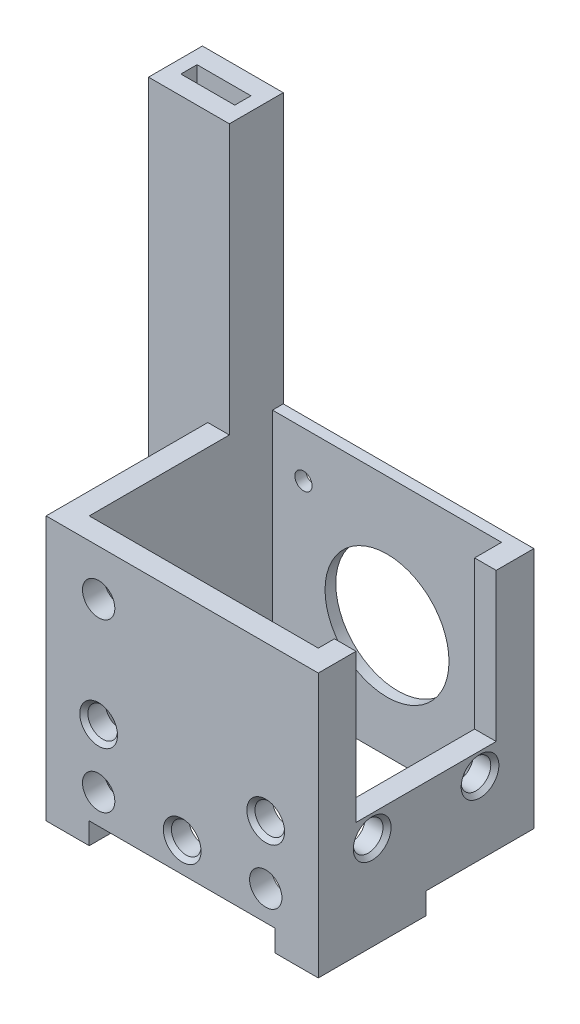
from build123d import *

# Parameters (mm, degrees)
SKETCH2_W                = 50.5
SKETCH2_H                = 40
SKETCH2_W_2              = 42.5
SKETCH2_H_2              = 34
BOSS_EXTRUDE1_DEPTH      = 45
CUT_EXTRUDE1_REACH       = 72.825
SKETCH3_W                = 26
SKETCH3_H                = 27.5
CUT_EXTRUDE2_REACH       = 67.288
SKETCH4_R                = 11.5
SKETCH4_R_2              = 1.6
CUT_EXTRUDE3_REACH       = 67.288
SKETCH5_R                = 3
CUT_EXTRUDE4_REACH       = 67.288
SKETCH6_R                = 2.75
SKETCH7_R                = 2.75
CUT_EXTRUDE5_DEPTH       = 71.825489762
SKETCH8_W                = 8
SKETCH8_H                = 25
BOSS_EXTRUDE2_DEPTH      = 4
SKETCH9_R                = 2.25
CUT_EXTRUDE6_DEPTH       = 4
CHAMFER1_SIZE            = 0.75
BOSS_EXTRUDE3_DEPTH      = 50
BOSS_EXTRUDE3_DEPTH_BACK = 25
SKETCH10_W               = 15
SKETCH10_H               = 10
SKETCH11_W               = 10
SKETCH11_H               = 3
CUT_EXTRUDE7_DEPTH       = 75


with BuildPart() as part:
    # Sketch2 → Boss-Extrude1 (new body)
    with BuildSketch(Plane(origin=(0, 0, 0), x_dir=(1, 0, 0), z_dir=(0, 1, 0))):
        with Locations((0, -1)):
            Rectangle(SKETCH2_W, SKETCH2_H)
        Rectangle(SKETCH2_W_2, SKETCH2_H_2, mode=Mode.SUBTRACT)
    extrude(amount=BOSS_EXTRUDE1_DEPTH)

    # Sketch3 → Cut-Extrude1 (cut, up to next)
    with BuildSketch(Plane(origin=(25.25, 0, 0), x_dir=(0, 0, -1), z_dir=(1, 0, 0)), mode=Mode.PRIVATE) as cut_extrude1_sk1:
        with Locations((-1, 31.25)):
            Rectangle(SKETCH3_W, SKETCH3_H)
    cut_extrude1_tool1 = extrude(cut_extrude1_sk1.sketch, amount=-CUT_EXTRUDE1_REACH, mode=Mode.PRIVATE) & part.part
    add(cut_extrude1_tool1.solids().sort_by_distance((25.25, 31.25, 1))[0], mode=Mode.SUBTRACT)

    # Sketch4 → Cut-Extrude2 (cut, up to next)
    with BuildSketch(Plane(origin=(0, 0, -19), x_dir=(-1, 0, 0), z_dir=(0, 0, -1)), mode=Mode.PRIVATE) as cut_extrude2_sk1:
        with Locations((0, 21)):
            Circle(SKETCH4_R)
    cut_extrude2_tool1 = extrude(cut_extrude2_sk1.sketch, amount=-CUT_EXTRUDE2_REACH, mode=Mode.PRIVATE) & part.part
    # Sketch4 → Cut-Extrude2 (cut, up to next)
    with BuildSketch(Plane(origin=(0, 0, -19), x_dir=(-1, 0, 0), z_dir=(0, 0, -1)), mode=Mode.PRIVATE) as cut_extrude2_sk2:
        with Locations((-15.5, 5.5)):
            Circle(SKETCH4_R_2)
    cut_extrude2_tool2 = extrude(cut_extrude2_sk2.sketch, amount=-CUT_EXTRUDE2_REACH, mode=Mode.PRIVATE) & part.part
    # Sketch4 → Cut-Extrude2 (cut, up to next)
    with BuildSketch(Plane(origin=(0, 0, -19), x_dir=(-1, 0, 0), z_dir=(0, 0, -1)), mode=Mode.PRIVATE) as cut_extrude2_sk3:
        with Locations((15.5, 5.5)):
            Circle(SKETCH4_R_2)
    cut_extrude2_tool3 = extrude(cut_extrude2_sk3.sketch, amount=-CUT_EXTRUDE2_REACH, mode=Mode.PRIVATE) & part.part
    # Sketch4 → Cut-Extrude2 (cut, up to next)
    with BuildSketch(Plane(origin=(0, 0, -19), x_dir=(-1, 0, 0), z_dir=(0, 0, -1)), mode=Mode.PRIVATE) as cut_extrude2_sk4:
        with Locations((15.5, 36.5)):
            Circle(SKETCH4_R_2)
    cut_extrude2_tool4 = extrude(cut_extrude2_sk4.sketch, amount=-CUT_EXTRUDE2_REACH, mode=Mode.PRIVATE) & part.part
    add(cut_extrude2_tool1.solids().sort_by_distance((0, 21, -19))[0], mode=Mode.SUBTRACT)
    add(cut_extrude2_tool2.solids().sort_by_distance((15.5, 5.5, -19))[0], mode=Mode.SUBTRACT)
    add(cut_extrude2_tool3.solids().sort_by_distance((-15.5, 5.5, -19))[0], mode=Mode.SUBTRACT)
    add(cut_extrude2_tool4.solids().sort_by_distance((-15.5, 36.5, -19))[0], mode=Mode.SUBTRACT)

    # Sketch5 → Cut-Extrude3 (cut, up to next)
    with BuildSketch(Plane.XY.offset(21), mode=Mode.PRIVATE) as cut_extrude3_sk1:
        with Locations((-15.5, 36.5)):
            Circle(SKETCH5_R)
    cut_extrude3_tool1 = extrude(cut_extrude3_sk1.sketch, amount=-CUT_EXTRUDE3_REACH, mode=Mode.PRIVATE) & part.part
    # Sketch5 → Cut-Extrude3 (cut, up to next)
    with BuildSketch(Plane.XY.offset(21), mode=Mode.PRIVATE) as cut_extrude3_sk2:
        with Locations((-15.5, 5.5)):
            Circle(SKETCH5_R)
    cut_extrude3_tool2 = extrude(cut_extrude3_sk2.sketch, amount=-CUT_EXTRUDE3_REACH, mode=Mode.PRIVATE) & part.part
    # Sketch5 → Cut-Extrude3 (cut, up to next)
    with BuildSketch(Plane.XY.offset(21), mode=Mode.PRIVATE) as cut_extrude3_sk3:
        with Locations((15.5, 5.5)):
            Circle(SKETCH5_R)
    cut_extrude3_tool3 = extrude(cut_extrude3_sk3.sketch, amount=-CUT_EXTRUDE3_REACH, mode=Mode.PRIVATE) & part.part
    add(cut_extrude3_tool1.solids().sort_by_distance((-15.5, 36.5, 21))[0], mode=Mode.SUBTRACT)
    add(cut_extrude3_tool2.solids().sort_by_distance((-15.5, 5.5, 21))[0], mode=Mode.SUBTRACT)
    add(cut_extrude3_tool3.solids().sort_by_distance((15.5, 5.5, 21))[0], mode=Mode.SUBTRACT)

    # Sketch6 → Cut-Extrude4 (cut, up to next)
    with BuildSketch(Plane.XY.offset(21), mode=Mode.PRIVATE) as cut_extrude4_sk1:
        with Locations((-15.5, 16.365063509)):
            Circle(SKETCH6_R)
    cut_extrude4_tool1 = extrude(cut_extrude4_sk1.sketch, amount=-CUT_EXTRUDE4_REACH, mode=Mode.PRIVATE) & part.part
    # Sketch6 → Cut-Extrude4 (cut, up to next)
    with BuildSketch(Plane.XY.offset(21), mode=Mode.PRIVATE) as cut_extrude4_sk2:
        with Locations((0, 5.5)):
            Circle(SKETCH6_R)
    cut_extrude4_tool2 = extrude(cut_extrude4_sk2.sketch, amount=-CUT_EXTRUDE4_REACH, mode=Mode.PRIVATE) & part.part
    # Sketch6 → Cut-Extrude4 (cut, up to next)
    with BuildSketch(Plane.XY.offset(21), mode=Mode.PRIVATE) as cut_extrude4_sk3:
        with Locations((15.5, 16.365063509)):
            Circle(SKETCH6_R)
    cut_extrude4_tool3 = extrude(cut_extrude4_sk3.sketch, amount=-CUT_EXTRUDE4_REACH, mode=Mode.PRIVATE) & part.part
    add(cut_extrude4_tool1.solids().sort_by_distance((-15.5, 16.365064, 21))[0], mode=Mode.SUBTRACT)
    add(cut_extrude4_tool2.solids().sort_by_distance((0, 5.5, 21))[0], mode=Mode.SUBTRACT)
    add(cut_extrude4_tool3.solids().sort_by_distance((15.5, 16.365064, 21))[0], mode=Mode.SUBTRACT)

    # Sketch7 → Cut-Extrude5 (cut, through all)
    with BuildSketch(Plane(origin=(25.25, 0, 0), x_dir=(0, 0, -1), z_dir=(1, 0, 0))):
        with Locations((-11, 13.440603491)):
            Circle(SKETCH7_R)
        with Locations((9, 13.440603491)):
            Circle(SKETCH7_R)
    extrude(amount=-CUT_EXTRUDE5_DEPTH, mode=Mode.SUBTRACT)

    # Sketch8 → Boss-Extrude2 (add)
    with BuildSketch(Plane.XZ):
        Polygon((19, 1), (17.25, 11), (17.25, 21), (25.25, 21), (25.25, 1), align=None)
        with Locations((-21.25, 8.5)):
            Rectangle(SKETCH8_W, SKETCH8_H)
    extrude(amount=BOSS_EXTRUDE2_DEPTH)

    # Sketch9 → Cut-Extrude6 (cut)
    with BuildSketch(Plane.XZ.offset(4)):
        with Locations(Location((-21.25, 13, 0), (0, 0, 270))):
            Circle(SKETCH9_R)
        with Locations(Location((-21.25, 0.5, 0), (0, 0, 270))):
            Circle(SKETCH9_R)
        with Locations(Location((21.25, 6, 0), (0, 0, 270))):
            Circle(SKETCH9_R)
        with Locations(Location((21.25, 16, 0), (0, 0, 270))):
            Circle(SKETCH9_R)
    extrude(amount=-CUT_EXTRUDE6_DEPTH, mode=Mode.SUBTRACT)

    # Chamfer1
    chamfer1_edges = [part.edges().sort_by_distance(p)[0] for p in [
        (21.25, -4, 18.25),
        (21.25, -4, 8.25),
        (-21.25, -4, 2.75),
        (-21.25, -4, 15.25),
        (-18.25, 16.365063509, 21),
        (-2.75, 5.5, 21),
        (12.75, 16.365063509, 21),
        (-25.25, 13.440603491, 13.75),
        (25.25, 13.440603491, 13.75),
        (-25.25, 13.440603491, -6.25),
        (25.25, 13.440603491, -6.25),
    ]]
    chamfer(chamfer1_edges, length=CHAMFER1_SIZE)

    # Sketch10 → Boss-Extrude3 (add, two sides: drawn at the far end of the back side and taken through both)
    with BuildSketch(Plane(origin=(0, 45, 0), x_dir=(1, 0, 0), z_dir=(0, 1, 0)).offset(-BOSS_EXTRUDE3_DEPTH_BACK)):
        with Locations((-28.75, 14)):
            Rectangle(SKETCH10_W, SKETCH10_H)
    extrude(amount=BOSS_EXTRUDE3_DEPTH + BOSS_EXTRUDE3_DEPTH_BACK)

    # Sketch11 → Cut-Extrude7 (cut)
    with BuildSketch(Plane(origin=(0, 95, 0), x_dir=(1, 0, 0), z_dir=(0, 1, 0))):
        with Locations((-28.75, 14)):
            Rectangle(SKETCH11_W, SKETCH11_H)
    extrude(amount=-CUT_EXTRUDE7_DEPTH, mode=Mode.SUBTRACT)


solid = part.part
